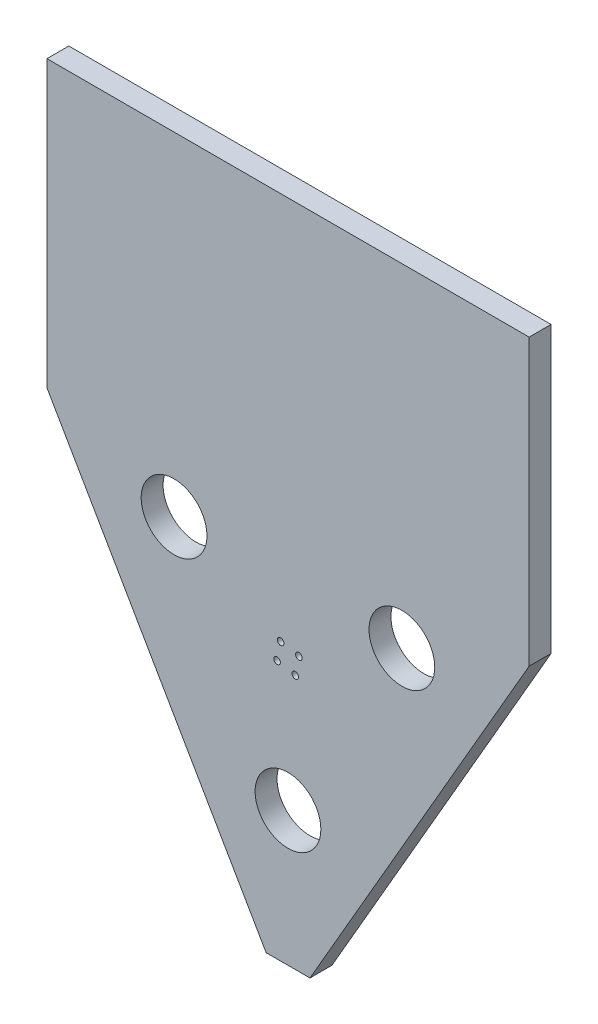
from build123d import *

# Parameters (mm, degrees)
SKETCH5_R           = 15
SKETCH5_R_2         = 10
SKETCH5_R_3         = 1.5
BOSS_EXTRUDE1_DEPTH = 10


with BuildPart() as part:
    # Sketch5 → Boss-Extrude1 (new body)
    # profile 1 of 2: a face of its own
    with BuildSketch(Plane.XY):
        Polygon((-349.776309557, -150.606198532), (-449.776309557, -323.811279288), (-469.776309557, -323.811279288), (-569.776309557, -150.606198532), (-569.776309557, -20.606198532), (-349.776309557, -20.606198532), align=None)
        with Locations((-459.807870528, -262.585944494)):
            Circle(SKETCH5_R, mode=Mode.SUBTRACT)
        with Locations((-511.769394755, -172.585944494)):
            Circle(SKETCH5_R, mode=Mode.SUBTRACT)
        with Locations((-459.807870528, -202.585944494)):
            Circle(SKETCH5_R_2, mode=Mode.SUBTRACT)
        with Locations((-407.846346301, -172.585944494)):
            Circle(SKETCH5_R, mode=Mode.SUBTRACT)
    # profile 2 of 2: a face of its own
    with BuildSketch(Plane.XY):
        with Locations((-459.807870528, -202.585944494)):
            Circle(SKETCH5_R_2)
        with Locations((-464.790983154, -205.927888323)):
            Circle(SKETCH5_R_3, mode=Mode.SUBTRACT)
        with Locations((-456.465926699, -207.56905712)):
            Circle(SKETCH5_R_3, mode=Mode.SUBTRACT)
        with Locations((-454.824757902, -199.244000664)):
            Circle(SKETCH5_R_3, mode=Mode.SUBTRACT)
        with Locations((-463.149814357, -197.602831868)):
            Circle(SKETCH5_R_3, mode=Mode.SUBTRACT)
    extrude(amount=BOSS_EXTRUDE1_DEPTH)


solid = part.part
